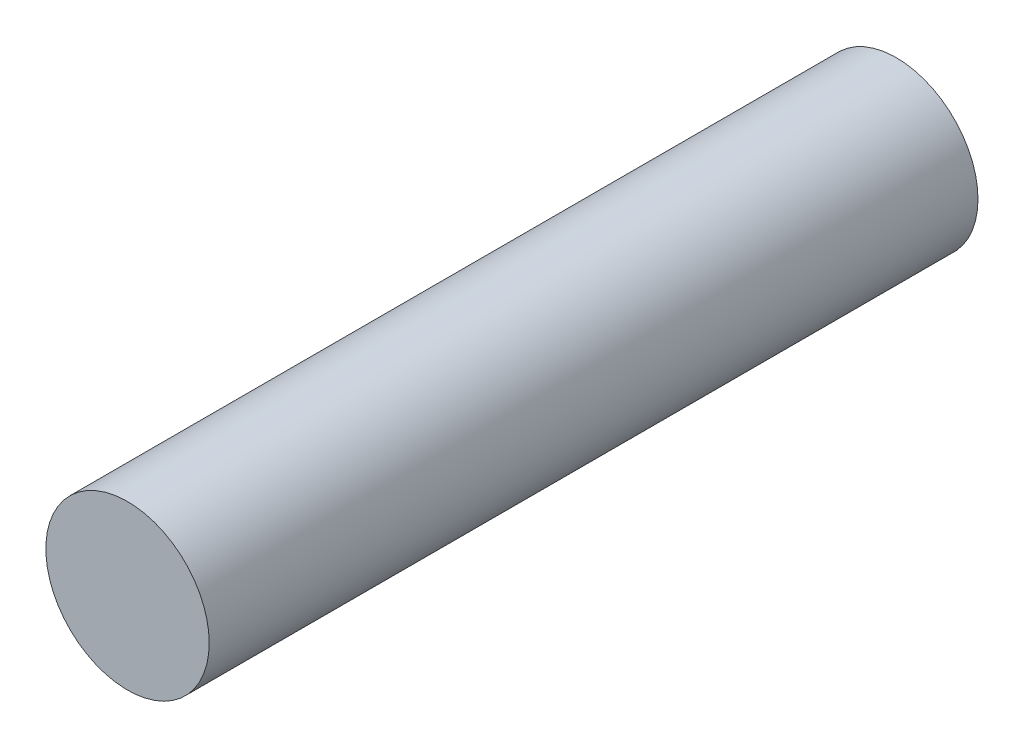
from build123d import *

# Parameters (mm, degrees)
SKETCH2_R           = 0.85
BOSS_EXTRUDE1_DEPTH = 8


with BuildPart() as part:
    # Sketch2 → Boss-Extrude1 (new body)
    with BuildSketch(Plane.XY):
        Circle(SKETCH2_R)
    extrude(amount=BOSS_EXTRUDE1_DEPTH)


solid = part.part
